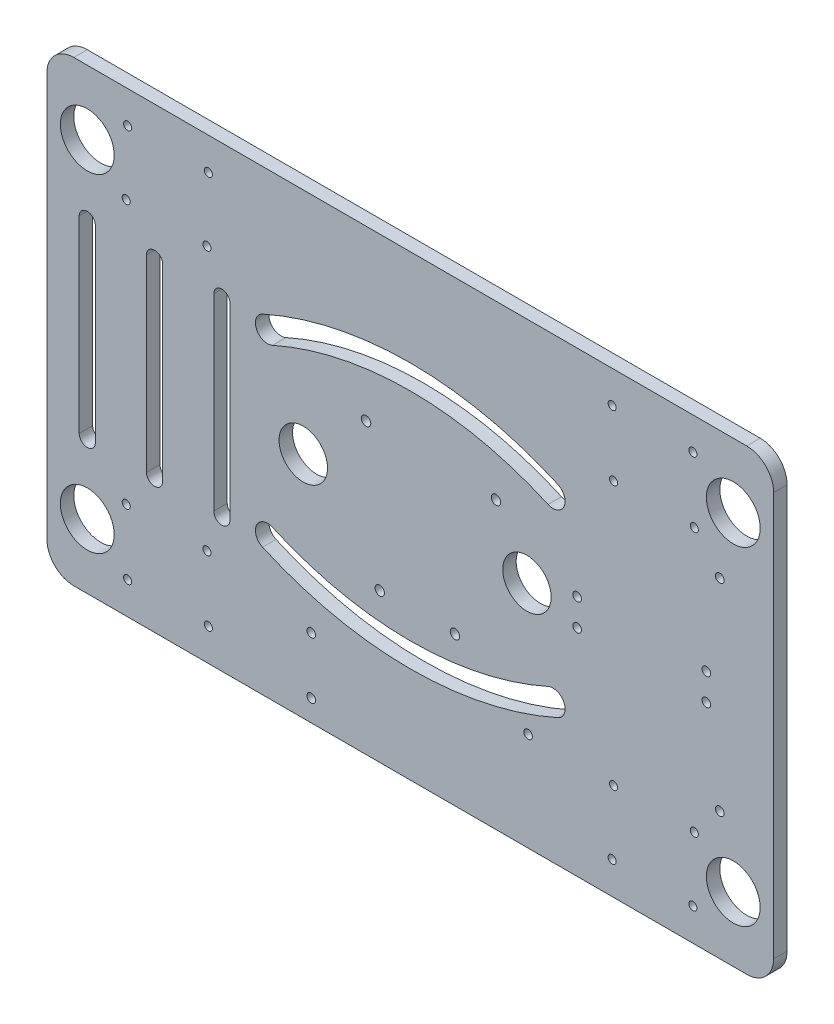
from build123d import *

# Parameters (mm, degrees)
SKETCH_2_R      = 1.5
SKETCH_2_R_2    = 1.6
SKETCH_2_R_3    = 1.75
SKETCH_2_R_4    = 9
SKETCH_2_R_5    = 10
EXTRUDE_1_DEPTH = 5


with BuildPart() as part:
    # 草图2 → 凸台-拉伸1 (new body)
    with BuildSketch(Plane.XY):
        with BuildLine():
            Line((-165.542218516, 84.933067874), (84.457781484, 84.933067874))
            ThreePointArc((84.457781484, 84.933067874), (91.528849296, 82.004135686), (94.457781484, 74.933067874))
            Line((94.457781484, 74.933067874), (94.457781484, -75.066932126))
            ThreePointArc((94.457781484, -75.066932126), (91.528849296, -82.137999937), (84.457781484, -85.066932126))
            Line((84.457781484, -85.066932126), (-165.542218516, -85.066932126))
            ThreePointArc((-165.542218516, -85.066932126), (-172.613286328, -82.137999937), (-175.542218516, -75.066932126))
            Line((-175.542218516, -75.066932126), (-175.542218516, 74.933067874))
            ThreePointArc((-175.542218516, 74.933067874), (-172.613286328, 82.004135686), (-165.542218516, 84.933067874))
        make_face()
        with Locations((-145.542218516, 72.933067874)):
            Circle(SKETCH_2_R, mode=Mode.SUBTRACT)
        with Locations((-115.542218516, 72.933067874)):
            Circle(SKETCH_2_R, mode=Mode.SUBTRACT)
        with Locations((-146.065799187, 48.933067874)):
            Circle(SKETCH_2_R, mode=Mode.SUBTRACT)
        with Locations((-116.065799187, 48.933067874)):
            Circle(SKETCH_2_R, mode=Mode.SUBTRACT)
        with Locations(Location((-116.065799187, -49.066932126, 0), (0, 0, 180))):
            Circle(SKETCH_2_R, mode=Mode.SUBTRACT)
        with Locations(Location((-115.542218516, -73.066932126, 0), (0, 0, 180))):
            Circle(SKETCH_2_R, mode=Mode.SUBTRACT)
        with Locations(Location((-145.542218516, -73.066932126, 0), (0, 0, 180))):
            Circle(SKETCH_2_R, mode=Mode.SUBTRACT)
        with Locations(Location((-146.065799187, -49.066932126, 0), (0, 0, 180))):
            Circle(SKETCH_2_R, mode=Mode.SUBTRACT)
        with Locations(Location((64.981362155, 48.933067874, 0), (0, 0, 180))):
            Circle(SKETCH_2_R, mode=Mode.SUBTRACT)
        with Locations(Location((34.981362155, 48.933067874, 0), (0, 0, 180))):
            Circle(SKETCH_2_R, mode=Mode.SUBTRACT)
        with Locations(Location((34.457781484, 72.933067874, 0), (0, 0, 180))):
            Circle(SKETCH_2_R, mode=Mode.SUBTRACT)
        with Locations(Location((64.457781484, 72.933067874, 0), (0, 0, 180))):
            Circle(SKETCH_2_R, mode=Mode.SUBTRACT)
        with Locations((34.457781484, -73.066932126)):
            Circle(SKETCH_2_R, mode=Mode.SUBTRACT)
        with Locations((34.981362155, -49.066932126)):
            Circle(SKETCH_2_R, mode=Mode.SUBTRACT)
        with Locations((64.981362155, -49.066932126)):
            Circle(SKETCH_2_R, mode=Mode.SUBTRACT)
        with Locations((64.457781484, -73.066932126)):
            Circle(SKETCH_2_R, mode=Mode.SUBTRACT)
        with Locations((74.457781484, 37.433067874)):
            Circle(SKETCH_2_R_2, mode=Mode.SUBTRACT)
        with Locations(Location((74.457781484, -37.566932126, 0), (0, 0, 180))):
            Circle(SKETCH_2_R_2, mode=Mode.SUBTRACT)
        with Locations((69.457781484, 4.933067874)):
            Circle(SKETCH_2_R_2, mode=Mode.SUBTRACT)
        with Locations((21.457781484, 4.933067874)):
            Circle(SKETCH_2_R_2, mode=Mode.SUBTRACT)
        with Locations(Location((69.457781484, -5.066932126, 0), (0, 0, 180))):
            Circle(SKETCH_2_R_2, mode=Mode.SUBTRACT)
        with Locations(Location((21.457781484, -5.066932126, 0), (0, 0, 180))):
            Circle(SKETCH_2_R_2, mode=Mode.SUBTRACT)
        with Locations((-23.944476924, -29.764734827)):
            Circle(SKETCH_2_R_3, mode=Mode.SUBTRACT)
        with Locations((-51.884476924, -29.764734827)):
            Circle(SKETCH_2_R_3, mode=Mode.SUBTRACT)
        with Locations((-8.704476924, 21.035265173)):
            Circle(SKETCH_2_R_3, mode=Mode.SUBTRACT)
        with Locations((-56.964476924, 22.305265173)):
            Circle(SKETCH_2_R_3, mode=Mode.SUBTRACT)
        with Locations((2.799841961, -0.066932126)):
            Circle(SKETCH_2_R_4, mode=Mode.SUBTRACT)
        with Locations((-80.295672717, -0.066932126)):
            Circle(SKETCH_2_R_4, mode=Mode.SUBTRACT)
        with Locations((-160.542218516, 60.933067874)):
            Circle(SKETCH_2_R_5, mode=Mode.SUBTRACT)
        with Locations(Location((-160.542218516, -61.066932126, 0), (0, 0, 180))):
            Circle(SKETCH_2_R_5, mode=Mode.SUBTRACT)
        with Locations((-77.330354065, -56.066932126)):
            Circle(SKETCH_2_R_2, mode=Mode.SUBTRACT)
        with Locations((-77.330354065, -77.066932126)):
            Circle(SKETCH_2_R_2, mode=Mode.SUBTRACT)
        with Locations((3.229701528, -48.443032681)):
            Circle(SKETCH_2_R_2, mode=Mode.SUBTRACT)
        with Locations((79.457781484, -61.066932126)):
            Circle(SKETCH_2_R_5, mode=Mode.SUBTRACT)
        with Locations(Location((79.457781484, 60.933067874, 0), (0, 0, 180))):
            Circle(SKETCH_2_R_5, mode=Mode.SUBTRACT)
        with BuildLine():
            Line((-157.542218516, 34.913165474), (-157.542218516, -35.047029725))
            ThreePointArc((-157.542218516, -35.047029725), (-160.542218516, -38.047029725), (-163.542218516, -35.047029725))
            Line((-163.542218516, -35.047029725), (-163.542218516, 34.913165474))
            ThreePointArc((-163.542218516, 34.913165474), (-160.542218516, 37.913165474), (-157.542218516, 34.913165474))
        make_face(mode=Mode.SUBTRACT)
        with BuildLine():
            Line((-132.542218516, 34.913165474), (-132.542218516, -35.047029725))
            ThreePointArc((-132.542218516, -35.047029725), (-135.542218516, -38.047029725), (-138.542218516, -35.047029725))
            Line((-138.542218516, -35.047029725), (-138.542218516, 34.913165474))
            ThreePointArc((-138.542218516, 34.913165474), (-135.542218516, 37.913165474), (-132.542218516, 34.913165474))
        make_face(mode=Mode.SUBTRACT)
        with BuildLine():
            Line((-107.542218516, 34.913165474), (-107.542218516, -35.047029725))
            ThreePointArc((-107.542218516, -35.047029725), (-110.542218516, -38.047029725), (-113.542218516, -35.047029725))
            Line((-113.542218516, -35.047029725), (-113.542218516, 34.913165474))
            ThreePointArc((-113.542218516, 34.913165474), (-110.542218516, 37.913165474), (-107.542218516, 34.913165474))
        make_face(mode=Mode.SUBTRACT)
        with BuildLine():
            ThreePointArc((-95.414503132, -37.564666946), (-40.542218516, -49.29309446), (14.330066101, -37.564666946))
            ThreePointArc((14.330066101, -37.564666946), (16.597243532, -31.618247309), (10.650823895, -29.351069878))
            ThreePointArc((10.650823895, -29.351069878), (-40.542218516, -40.29309446), (-91.735260926, -29.351069878))
            ThreePointArc((-91.735260926, -29.351069878), (-97.681680563, -31.618247309), (-95.414503132, -37.564666946))
        make_face(mode=Mode.SUBTRACT)
        with BuildLine():
            ThreePointArc((-95.414503132, 37.430802695), (-40.542218516, 49.159230209), (14.330066101, 37.430802695))
            ThreePointArc((14.330066101, 37.430802695), (16.597243532, 31.484383058), (10.650823895, 29.217205627))
            ThreePointArc((10.650823895, 29.217205627), (-40.542218516, 40.159230209), (-91.735260926, 29.217205627))
            ThreePointArc((-91.735260926, 29.217205627), (-97.681680563, 31.484383058), (-95.414503132, 37.430802695))
        make_face(mode=Mode.SUBTRACT)
    extrude(amount=EXTRUDE_1_DEPTH)


solid = part.part
